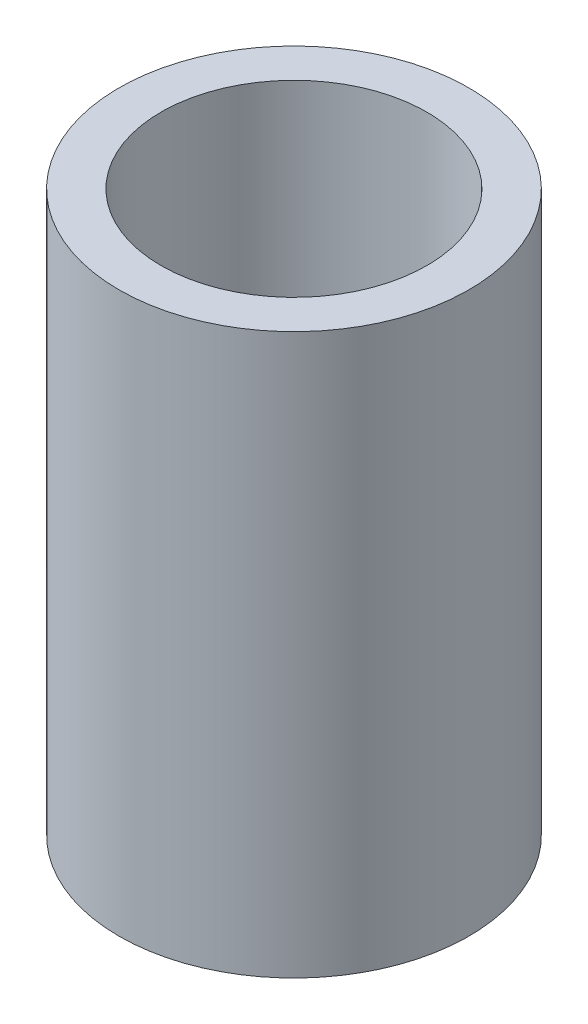
from build123d import *

# Parameters (mm, degrees)
SKETCH1_R           = 12.5
SKETCH1_R_2         = 9.5
BOSS_EXTRUDE1_DEPTH = 40


with BuildPart() as part:
    # Sketch1 → Boss-Extrude1 (new body)
    with BuildSketch(Plane(origin=(0, 0, 0), x_dir=(1, 0, 0), z_dir=(0, 1, 0))):
        with Locations(Location((0, 0, 0), (0, 0, 270))):
            Circle(SKETCH1_R)
        with Locations(Location((0, 0, 0), (0, 0, 270))):
            Circle(SKETCH1_R_2, mode=Mode.SUBTRACT)
    extrude(amount=BOSS_EXTRUDE1_DEPTH)


solid = part.part
